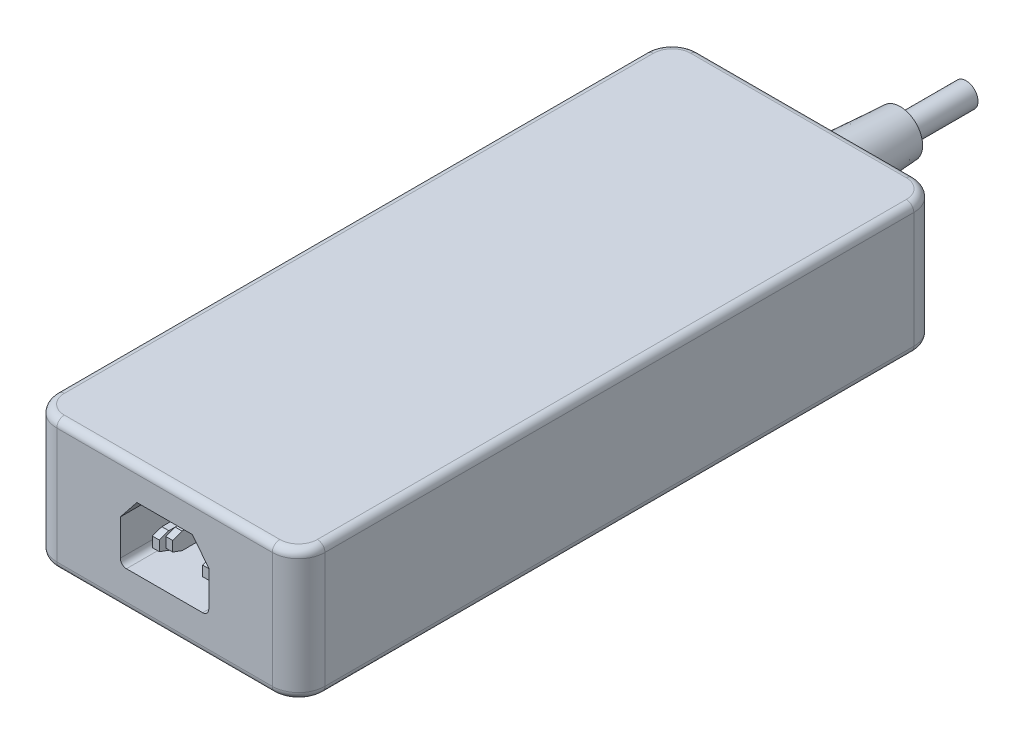
from build123d import *
from OCP.BRepFilletAPI import BRepFilletAPI_MakeChamfer

# Parameters (mm, degrees)
SKETCH1_W           = 72.39
SKETCH1_H           = 35.3568
BOSS_EXTRUDE1_DEPTH = 86.614
FILLET1_R           = 7.112
FILLET2_R           = 2.032
CUT_EXTRUDE1_DEPTH  = 17.0561
FILLET3_R           = 1.651
SKETCH3_W           = 1.8796
SKETCH3_H           = 4.572
BOSS_EXTRUDE2_DEPTH = 15.7861
SKETCH4_W           = 15.4432
SKETCH4_H           = 4.572
CUT_EXTRUDE2_DEPTH  = 3.175
CHAMFER1_SIZE       = 2.54
CHAMFER1_SIZE2      = 0.924484395
SKETCH5_R           = 7.62
BOSS_EXTRUDE3_DEPTH = 25.4
BOSS_EXTRUDE3_TAPER = 3.5
SKETCH7_R           = 3.2385
BOSS_EXTRUDE4_DEPTH = 32.766
SKETCH8_R           = 10.8966
BOSS_EXTRUDE5_DEPTH = 34.417
FILLET4_R           = 0.635
SKETCH9_R           = 3.2385
BOSS_EXTRUDE6_DEPTH = 34.417
SKETCH10_R          = 27.900404375
CUT_EXTRUDE3_DEPTH  = 83.82


with BuildPart() as part:
    # Sketch1 → Boss-Extrude1 (new, symmetric)
    with BuildSketch(Plane.XY):
        Rectangle(SKETCH1_W, SKETCH1_H)
    extrude(amount=BOSS_EXTRUDE1_DEPTH, both=True)

    # Fillet1
    fillet1_edges = [part.edges().sort_by_distance(p)[0] for p in [
        (36.195, 0, 86.614),
        (-36.195, 0, 86.614),
        (36.195, 0, -86.614),
        (-36.195, 0, -86.614),
    ]]
    fillet(fillet1_edges, radius=FILLET1_R)

    # Fillet2
    fillet2_edges = [part.edges().sort_by_distance(p)[0] for p in [
        (36.195, 17.6784, 0),
        (36.195, -17.6784, 0),
        (0, 17.6784, -86.614),
        (-36.195, 17.6784, 0),
        (0, 17.6784, 86.614),
        (-34.111943428, 17.6784, 84.530943428),
        (34.111943428, 17.6784, 84.530943428),
        (-34.111943428, 17.6784, -84.530943428),
        (34.111943428, 17.6784, -84.530943428),
        (0, -17.6784, -86.614),
        (0, -17.6784, 86.614),
        (-36.195, -17.6784, 0),
        (-34.111943428, -17.6784, 84.530943428),
        (34.111943428, -17.6784, 84.530943428),
        (-34.111943428, -17.6784, -84.530943428),
        (34.111943428, -17.6784, -84.530943428),
    ]]
    fillet(fillet2_edges, radius=FILLET2_R)

    # Sketch2 → Cut-Extrude1 (cut)
    with BuildSketch(Plane.XY.offset(86.614)):
        Polygon((7.47395, 9.0551), (-7.47395, 9.0551), (-11.938, 3.4544), (-11.938, -7.8359), (11.938, -7.8359), (11.938, 3.4544), align=None)
    extrude(amount=-CUT_EXTRUDE1_DEPTH, mode=Mode.SUBTRACT)

    # Fillet3
    fillet3_edges = [part.edges().sort_by_distance(p)[0] for p in [
        (11.938, -7.8359, 78.08595),
        (-11.938, -7.8359, 78.08595),
    ]]
    fillet(fillet3_edges, radius=FILLET3_R)

    # Sketch3 → Boss-Extrude2 (add)
    with BuildSketch(Plane.XY.offset(69.5579)):
        with Locations((-6.7818, -2.5019)):
            Rectangle(SKETCH3_W, SKETCH3_H)
        with Locations((0, 2.3876)):
            Rectangle(SKETCH3_W, SKETCH3_H)
        with Locations((6.7818, -2.5019)):
            Rectangle(SKETCH3_W, SKETCH3_H)
    extrude(amount=BOSS_EXTRUDE2_DEPTH)

    # Sketch4 → Cut-Extrude2 (cut)
    with BuildSketch(Plane.XY.offset(85.344)):
        with Locations((0, -2.5019)):
            Rectangle(SKETCH4_W, SKETCH4_H)
    extrude(amount=-CUT_EXTRUDE2_DEPTH, mode=Mode.SUBTRACT)

    # Chamfer1: one chamfer whose edges measure the first distance from different faces: ONE call of the kernel's chamfer builder (chamfer() names one face for all edges)
    chamfer1_edges_1 = [part.edges().sort_by_distance(p)[0] for p in [
        (0, 4.6736, 85.344),
    ]]
    chamfer1_side_1 = [part.faces().sort_by_distance(p)[0] for p in [
        (0, 4.6736, 77.45095),
    ]]
    chamfer1_edges_2 = [part.edges().sort_by_distance(p)[0] for p in [
        (0, 0.1016, 85.344),
    ]]
    chamfer1_side_2 = [part.faces().sort_by_distance(p)[0] for p in [
        (0, 0.1016, 77.45095),
    ]]
    chamfer1_edges_3 = [part.edges().sort_by_distance(p)[0] for p in [
        (-6.7818, -0.2159, 82.169),
    ]]
    chamfer1_side_3 = [part.faces().sort_by_distance(p)[0] for p in [
        (-6.7818, -0.2159, 75.86345),
    ]]
    chamfer1_edges_4 = [part.edges().sort_by_distance(p)[0] for p in [
        (6.7818, -0.2159, 82.169),
    ]]
    chamfer1_side_4 = [part.faces().sort_by_distance(p)[0] for p in [
        (6.7818, -0.2159, 75.86345),
    ]]
    chamfer1_edges_5 = [part.edges().sort_by_distance(p)[0] for p in [
        (-6.7818, -4.7879, 82.169),
    ]]
    chamfer1_side_5 = [part.faces().sort_by_distance(p)[0] for p in [
        (-6.7818, -4.7879, 75.86345),
    ]]
    chamfer1_edges_6 = [part.edges().sort_by_distance(p)[0] for p in [
        (6.7818, -4.7879, 82.169),
    ]]
    chamfer1_side_6 = [part.faces().sort_by_distance(p)[0] for p in [
        (6.7818, -4.7879, 75.86345),
    ]]
    chamfer1 = BRepFilletAPI_MakeChamfer(part.part.solid().wrapped)
    for e in chamfer1_edges_1:
        chamfer1.Add(CHAMFER1_SIZE, CHAMFER1_SIZE2, e.wrapped, chamfer1_side_1[0].wrapped)  # the first distance lies on this face
    for e in chamfer1_edges_2:
        chamfer1.Add(CHAMFER1_SIZE, CHAMFER1_SIZE2, e.wrapped, chamfer1_side_2[0].wrapped)  # the first distance lies on this face
    for e in chamfer1_edges_3:
        chamfer1.Add(CHAMFER1_SIZE, CHAMFER1_SIZE2, e.wrapped, chamfer1_side_3[0].wrapped)  # the first distance lies on this face
    for e in chamfer1_edges_4:
        chamfer1.Add(CHAMFER1_SIZE, CHAMFER1_SIZE2, e.wrapped, chamfer1_side_4[0].wrapped)  # the first distance lies on this face
    for e in chamfer1_edges_5:
        chamfer1.Add(CHAMFER1_SIZE, CHAMFER1_SIZE2, e.wrapped, chamfer1_side_5[0].wrapped)  # the first distance lies on this face
    for e in chamfer1_edges_6:
        chamfer1.Add(CHAMFER1_SIZE, CHAMFER1_SIZE2, e.wrapped, chamfer1_side_6[0].wrapped)  # the first distance lies on this face
    add(Compound.cast(chamfer1.Shape()), mode=Mode.REPLACE)

    # Sketch5 → Boss-Extrude3 (add)
    with BuildSketch(Plane(origin=(0, 0, -86.614), x_dir=(-1, 0, 0), z_dir=(0, 0, -1))):
        Circle(SKETCH5_R)
    extrude(amount=BOSS_EXTRUDE3_DEPTH, taper=BOSS_EXTRUDE3_TAPER)

    # Sketch7 → Boss-Extrude4 (add)
    with BuildSketch(Plane(origin=(0, 0, -112.014), x_dir=(-1, 0, 0), z_dir=(0, 0, -1))):
        Circle(SKETCH7_R)
    extrude(amount=BOSS_EXTRUDE4_DEPTH)

    # Sketch8 → Boss-Extrude5 (add)
    with BuildSketch(Plane(origin=(0, 0, -144.78), x_dir=(-1, 0, 0), z_dir=(0, 0, -1))):
        Circle(SKETCH8_R)
    extrude(amount=BOSS_EXTRUDE5_DEPTH)

    # Fillet4
    fillet4_edges = [part.edges().sort_by_distance(p)[0] for p in [
        (10.8966, 0, -144.78),
        (10.8966, 0, -179.197),
    ]]
    fillet(fillet4_edges, radius=FILLET4_R)

    # Sketch9 → Boss-Extrude6 (add)
    with BuildSketch(Plane(origin=(0, 0, -179.197), x_dir=(-1, 0, 0), z_dir=(0, 0, -1))):
        Circle(SKETCH9_R)
    extrude(amount=BOSS_EXTRUDE6_DEPTH)

    # Sketch10 → Cut-Extrude3 (cut)
    with BuildSketch(Plane(origin=(0, 0, -213.614), x_dir=(-1, 0, 0), z_dir=(0, 0, -1))):
        Circle(SKETCH10_R)
    extrude(amount=-CUT_EXTRUDE3_DEPTH, mode=Mode.SUBTRACT)


solid = part.part
